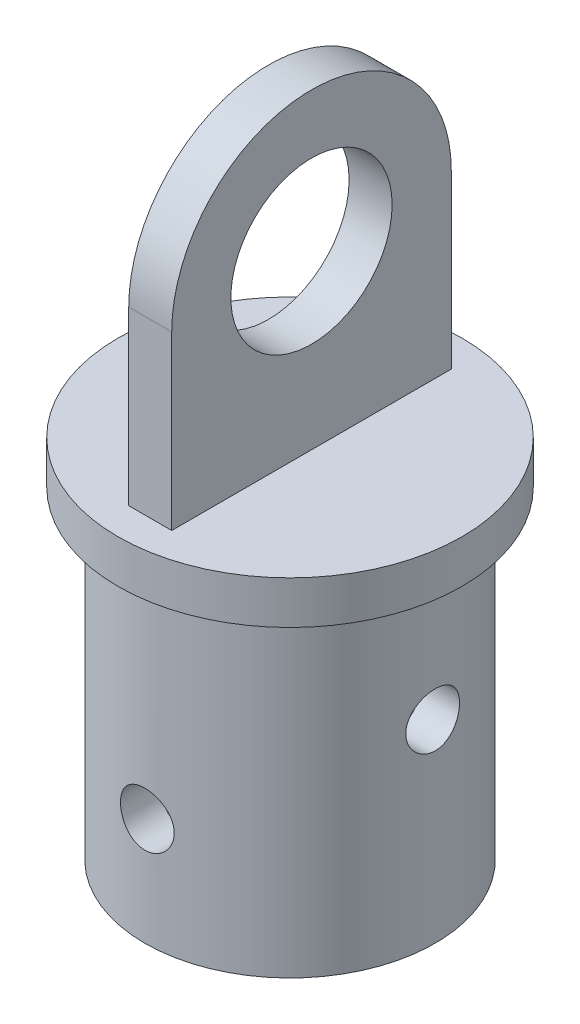
from build123d import *

# Parameters (mm, degrees)
SKETCH1_R               = 13.5
SKETCH1_R_2             = 10
BOSS_EXTRUDE1_DEPTH     = 30
BOSS_EXTRUDE2_START     = 30
SKETCH1_3_R             = 16
BOSS_EXTRUDE2_DEPTH     = 4
SKETCH2_R               = 7.5
BOSS_EXTRUDE3_DEPTH     = 2
CUT_EXTRUDE1_REACH      = 68.94
SKETCH2_3_R             = 2.5
CUT_EXTRUDE2_DEPTH      = 67.940271885
CUT_EXTRUDE2_DEPTH_BACK = 67.940271885
SKETCH3_R               = 2.5


with BuildPart() as part:
    # Sketch1 → Boss-Extrude1 (new body)
    with BuildSketch(Plane(origin=(0, 0, 0), x_dir=(1, 0, 0), z_dir=(0, 1, 0))):
        Circle(SKETCH1_R)
        Circle(SKETCH1_R_2, mode=Mode.SUBTRACT)
    extrude(amount=BOSS_EXTRUDE1_DEPTH)

    # Sketch1<3> → Boss-Extrude2 (add)
    with BuildSketch(Plane(origin=(0, 0, 0), x_dir=(1, 0, 0), z_dir=(0, 1, 0)).offset(BOSS_EXTRUDE2_START)):
        Circle(SKETCH1_3_R)
    extrude(amount=BOSS_EXTRUDE2_DEPTH)

    # Sketch2 → Boss-Extrude3 (add, symmetric)
    with BuildSketch(Plane(origin=(0, 0, 0), x_dir=(0, 0, -1), z_dir=(1, 0, 0))):
        with BuildLine():
            Line((13, 34), (13, 50))
            ThreePointArc((13, 50), (0, 63), (-13, 50))
            Line((-13, 50), (-13, 34))
            Line((-13, 34), (13, 34))
        make_face()
        with Locations((0, 50)):
            Circle(SKETCH2_R, mode=Mode.SUBTRACT)
    extrude(amount=BOSS_EXTRUDE3_DEPTH, both=True)

    # Sketch2<3> → Cut-Extrude1 (cut, up to next)
    with BuildSketch(Plane(origin=(0, 0, 0), x_dir=(0, 0, -1), z_dir=(1, 0, 0)), mode=Mode.PRIVATE) as cut_extrude1_sk1:
        with Locations((0, 18)):
            Circle(SKETCH2_3_R)
    cut_extrude1_tool1 = extrude(cut_extrude1_sk1.sketch, amount=CUT_EXTRUDE1_REACH, mode=Mode.PRIVATE) & part.part
    add(cut_extrude1_tool1.solids().sort_by_distance((0, 18, 0))[0], mode=Mode.SUBTRACT)

    # Sketch3 → Cut-Extrude2 (cut, two sides: drawn at the far end of the back side and taken through both)
    with BuildSketch(Plane.XY.offset(-CUT_EXTRUDE2_DEPTH_BACK)):
        with Locations((0, 10)):
            Circle(SKETCH3_R)
    extrude(amount=CUT_EXTRUDE2_DEPTH + CUT_EXTRUDE2_DEPTH_BACK, mode=Mode.SUBTRACT)


solid = part.part
